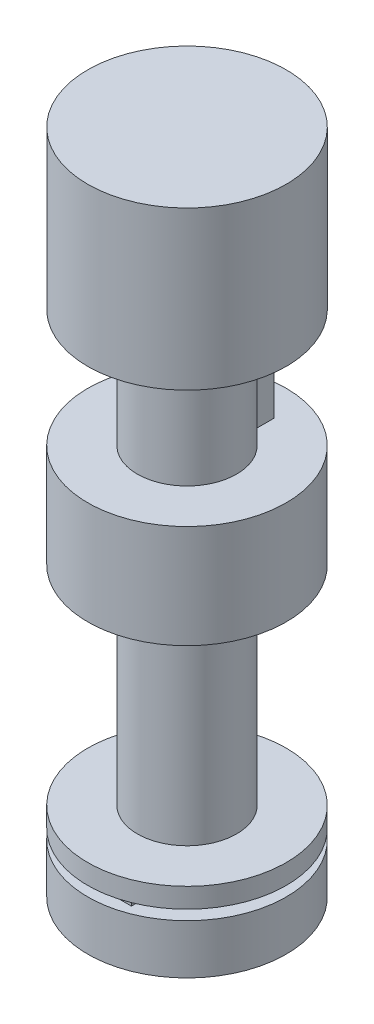
from build123d import *

# Parameters (mm, degrees)
SKETCH1_R           = 5
BOSS_EXTRUDE2_DEPTH = 11.9
SKETCH3_R           = 10
BOSS_EXTRUDE3_DEPTH = 15.9
BOSS_EXTRUDE4_START = 10.4
SKETCH5_R           = 10
BOSS_EXTRUDE4_DEPTH = 10.4
BOSS_EXTRUDE5_START = 23
SKETCH6_R           = 5
BOSS_EXTRUDE5_DEPTH = 23
SKETCH7_R           = 10
SKETCH7_R_2         = 5
BOSS_EXTRUDE6_DEPTH = 2
BOSS_EXTRUDE7_START = 1
SKETCH8_R           = 5
BOSS_EXTRUDE7_DEPTH = 1
BOSS_EXTRUDE8_START = 5
SKETCH9_R           = 10
BOSS_EXTRUDE8_DEPTH = 5


with BuildPart() as part:
    # Sketch1 → Boss-Extrude2 (new body)
    with BuildSketch(Plane(origin=(0, 0, 0), x_dir=(1, 0, 0), z_dir=(0, 1, 0))):
        Circle(SKETCH1_R)
        with BuildLine():
            Line((-2, 6.782575695), (-2, 4.582575695))
            ThreePointArc((-2, 4.582575695), (0, 5), (2, 4.582575695))
            Line((2, 4.582575695), (2, 6.782575695))
            Line((2, 6.782575695), (-2, 6.782575695))
        make_face()
    extrude(amount=BOSS_EXTRUDE2_DEPTH)

    # Sketch3 → Boss-Extrude3 (add)
    with BuildSketch(Plane(origin=(0, 11.9, 0), x_dir=(1, 0, 0), z_dir=(0, 1, 0))):
        with Locations(Location((0, 0, 0), (0, 0, 270))):
            Circle(SKETCH3_R)
    extrude(amount=BOSS_EXTRUDE3_DEPTH)

    # Sketch5 → Boss-Extrude4 (add)
    with BuildSketch(Plane.XZ.offset(BOSS_EXTRUDE4_START)):
        with Locations(Location((0, 0, 0), (0, 0, 90))):
            Circle(SKETCH5_R)
    extrude(amount=-BOSS_EXTRUDE4_DEPTH)

    # Sketch6 → Boss-Extrude5 (add)
    with BuildSketch(Plane.XZ.offset(10.4).offset(BOSS_EXTRUDE5_START)):
        with Locations(Location((0, 0, 0), (0, 0, 270))):
            Circle(SKETCH6_R)
    extrude(amount=-BOSS_EXTRUDE5_DEPTH)

    # Sketch7 → Boss-Extrude6 (add)
    with BuildSketch(Plane.XZ.offset(33.4)):
        with Locations(Location((0, 0, 0), (0, 0, 90))):
            Circle(SKETCH7_R)
        with Locations(Location((0, 0, 0), (0, 0, 270))):
            Circle(SKETCH7_R_2, mode=Mode.SUBTRACT)
    extrude(amount=-BOSS_EXTRUDE6_DEPTH)

    # Sketch8 → Boss-Extrude7 (add)
    with BuildSketch(Plane.XZ.offset(33.4).offset(BOSS_EXTRUDE7_START)):
        with Locations(Location((0, 0, 0), (0, 0, 270))):
            Circle(SKETCH8_R)
        with BuildLine():
            Line((-3, 8.6), (-3, 4))
            ThreePointArc((-3, 4), (0, 5), (3, 4))
            Line((3, 4), (3, 8.6))
            Line((3, 8.6), (-3, 8.6))
        make_face()
        with BuildLine():
            ThreePointArc((3, -4), (0, -5), (-3, -4))
            Line((-3, -4), (-3, -8.6))
            Line((-3, -8.6), (3, -8.6))
            Line((3, -8.6), (3, -4))
        make_face()
    extrude(amount=-BOSS_EXTRUDE7_DEPTH)

    # Sketch9 → Boss-Extrude8 (add)
    with BuildSketch(Plane(origin=(0, -34.4, 0), x_dir=(-1, 0, 0), z_dir=(0, -1, 0)).offset(BOSS_EXTRUDE8_START)):
        with Locations(Location((0, 0, 0), (0, 0, 270))):
            Circle(SKETCH9_R)
    extrude(amount=-BOSS_EXTRUDE8_DEPTH)


solid = part.part
